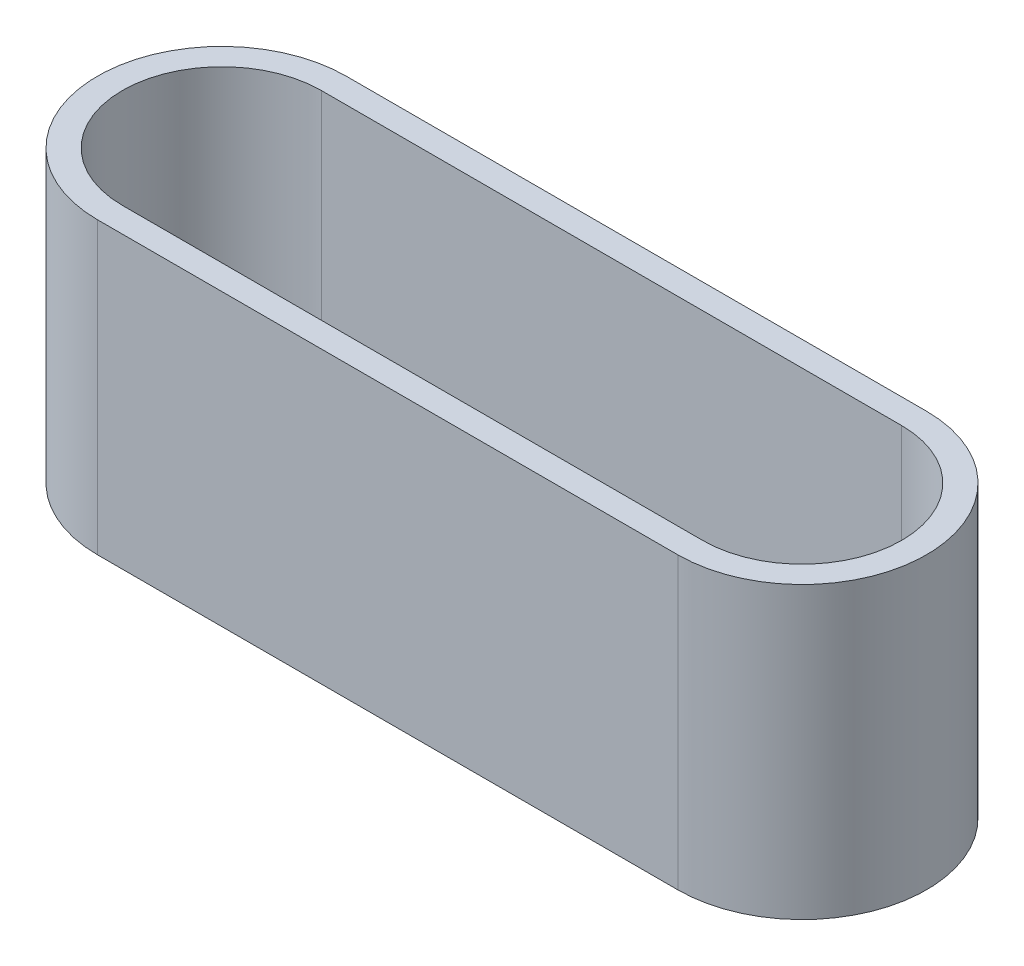
from build123d import *

# Parameters (mm, degrees)
BOSS_EXTRUDE1_DEPTH = 35


with BuildPart() as part:
    # Sketch1 → Boss-Extrude1 (new body)
    with BuildSketch(Plane(origin=(0, 0, 0), x_dir=(1, 0, 0), z_dir=(0, 1, 0))):
        with BuildLine():
            Line((-35, 15), (35, 15))
            ThreePointArc((35, 15), (50, 0), (35, -15))
            Line((35, -15), (-35, -15))
            ThreePointArc((-35, -15), (-50, 0), (-35, 15))
        make_face()
        with BuildLine():
            Line((-35, 12), (35, 12))
            ThreePointArc((35, 12), (47, 0), (35, -12))
            Line((35, -12), (-35, -12))
            ThreePointArc((-35, -12), (-47, 0), (-35, 12))
        make_face(mode=Mode.SUBTRACT)
    extrude(amount=BOSS_EXTRUDE1_DEPTH)


solid = part.part
